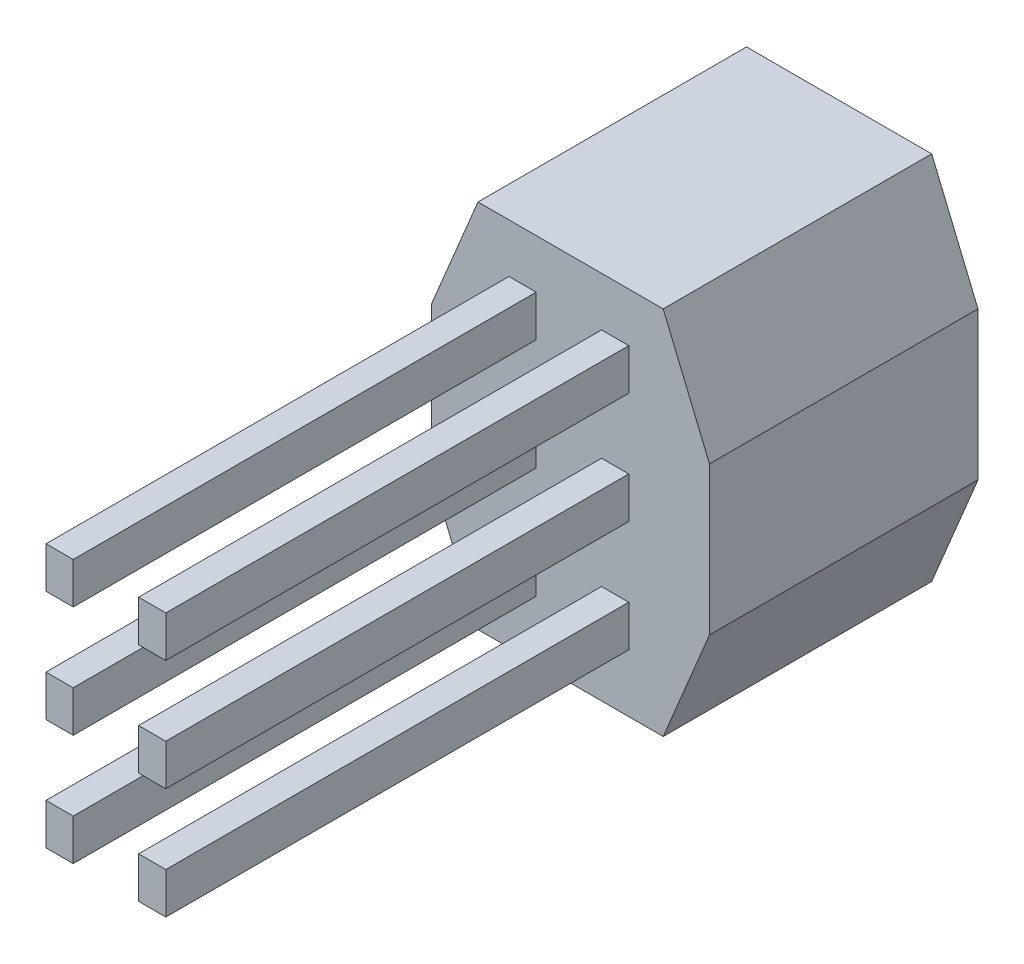
from build123d import *

# Parameters (mm, degrees)
EXTRUDE_1_DEPTH = 2.9
SKETCH_2_W      = 0.293894488
SKETCH_2_H      = 0.44460961
EXTRUDE_2_DEPTH = 5


with BuildPart() as part:
    # Эскиз1 → Бобышка-Вытянуть1 (new body)
    with BuildSketch(Plane.XY):
        Polygon((-392.814753218, 89.720587497), (-392.314753218, 90.920587497), (-390.314753218, 90.920587497), (-389.814753218, 89.720587497), (-389.814753218, 88.120587497), (-390.314753218, 86.920587497), (-392.314753218, 86.920587497), (-392.814753218, 88.120587497), align=None)
    extrude(amount=EXTRUDE_1_DEPTH)

    # Эскиз2 → Бобышка-Вытянуть2 (add)
    with BuildSketch(Plane.XY.offset(2.9)):
        with Locations((-390.83341038, 90.168528042)):
            Rectangle(SKETCH_2_W, SKETCH_2_H)
        with Locations((-391.83341038, 90.168528042)):
            Rectangle(SKETCH_2_W, SKETCH_2_H)
        with Locations((-390.83341038, 88.968528042)):
            Rectangle(SKETCH_2_W, SKETCH_2_H)
        with Locations((-390.83341038, 87.768528042)):
            Rectangle(SKETCH_2_W, SKETCH_2_H)
        with Locations((-391.83341038, 88.968528042)):
            Rectangle(SKETCH_2_W, SKETCH_2_H)
        with Locations((-391.83341038, 87.768528042)):
            Rectangle(SKETCH_2_W, SKETCH_2_H)
    extrude(amount=EXTRUDE_2_DEPTH)


solid = part.part
